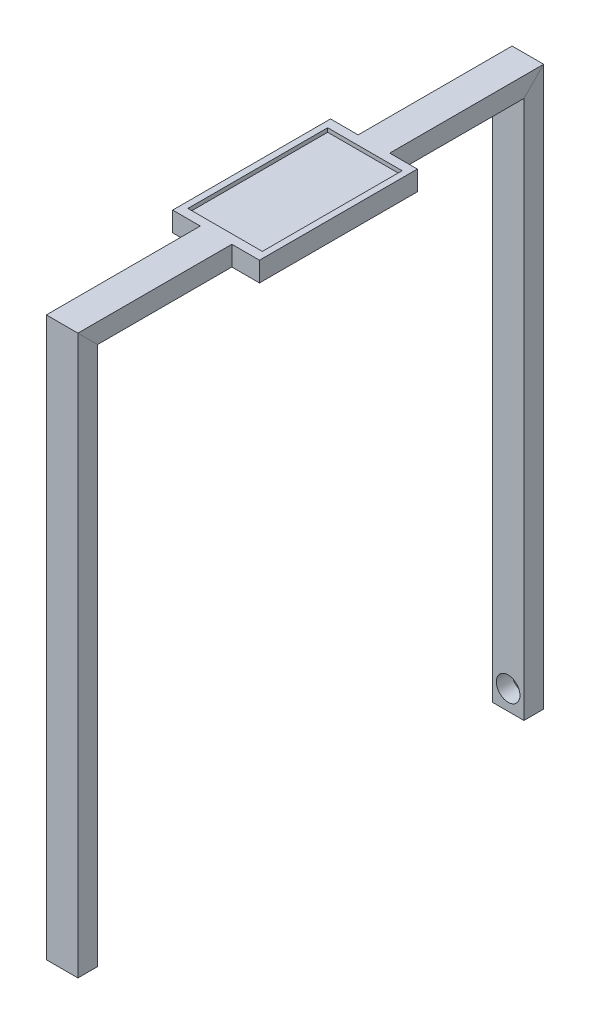
from build123d import *

# Parameters (mm, degrees)
SKETCH3_W               = 40
SKETCH3_H               = 25
CUT_EXTRUDE1_DEPTH      = 290
CUT_EXTRUDE1_DEPTH_BACK = 290
SKETCH4_R               = 15
SKETCH5_W               = 110
SKETCH5_H               = 200
BOSS_EXTRUDE1_DEPTH     = 25
SKETCH6_W               = 94.303635564
SKETCH6_H               = 177.0699427
CUT_EXTRUDE2_DEPTH      = 5


with BuildPart() as part:
    # Sweep1: sweep along a path in Sketch2
    with BuildLine(Plane(origin=(0, 0, 0), x_dir=(0, 0, -1), z_dir=(1, 0, 0))) as sweep1_path:
        Line((-282.5, 0), (-282.5, 695))
        Line((-282.5, 695), (282.5, 695))
        Line((282.5, 695), (282.5, 0))
    # Sketch3 → Sweep1 (sweep)
    with BuildSketch(Plane(origin=(0, 0, 0), x_dir=(1, 0, 0), z_dir=(0, 1, 0))):
        with Locations((0, -282.5)):
            Rectangle(SKETCH3_W, SKETCH3_H)
    sweep(path=sweep1_path.line, transition=Transition.RIGHT)

    # Sketch4 → Cut-Extrude1 (cut, two sides: drawn at the far end of the back side and taken through both)
    with BuildSketch(Plane.XY.offset(-CUT_EXTRUDE1_DEPTH_BACK)):
        with Locations(Location((0, 25, 0), (0, 0, 180))):
            Circle(SKETCH4_R)
    extrude(amount=CUT_EXTRUDE1_DEPTH + CUT_EXTRUDE1_DEPTH_BACK, mode=Mode.SUBTRACT)

    # Sketch5 → Boss-Extrude1 (add)
    with BuildSketch(Plane(origin=(0, 707.5, 0), x_dir=(1, 0, 0), z_dir=(0, 1, 0))):
        Rectangle(SKETCH5_W, SKETCH5_H)
    extrude(amount=-BOSS_EXTRUDE1_DEPTH)

    # Sketch6 → Cut-Extrude2 (cut)
    with BuildSketch(Plane(origin=(0, 707.5, 0), x_dir=(1, 0, 0), z_dir=(0, 1, 0))):
        Rectangle(SKETCH6_W, SKETCH6_H)
    extrude(amount=-CUT_EXTRUDE2_DEPTH, mode=Mode.SUBTRACT)


solid = part.part
